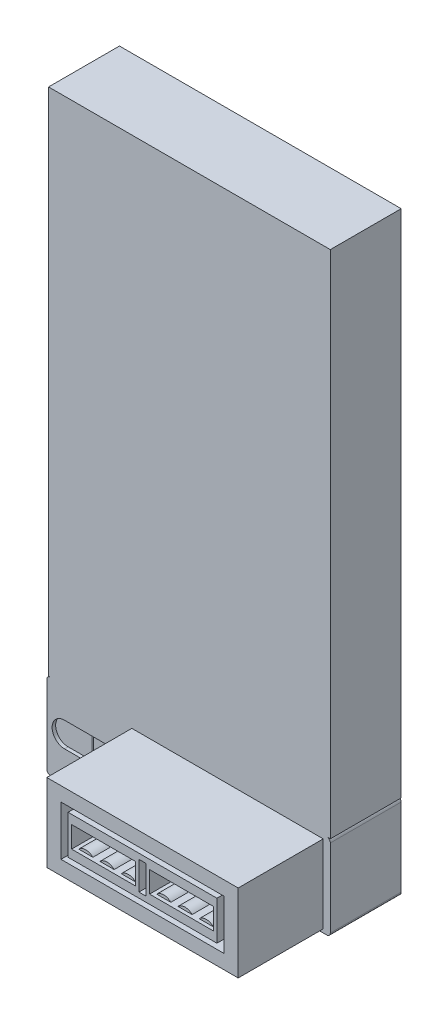
from build123d import *

# Parameters (mm, degrees)
SKETCH_1_W          = 27
SKETCH_1_H          = 11
EXTRUDE_1_DEPTH     = 12
SKETCH_2_W          = 23
SKETCH_2_H          = 7
CUT_EXTRUDE_1_DEPTH = 8
SKETCH_3_W          = 21
SKETCH_3_H          = 5.5
EXTRUDE_2_DEPTH     = 8
SKETCH_4_W          = 9
SKETCH_4_H          = 3
CUT_EXTRUDE_2_DEPTH = 4
SKETCH_5_W          = 1
SKETCH_5_H          = 4
CUT_EXTRUDE_3_DEPTH = 1
EXTRUDE_3_DEPTH     = 3.5
EXTRUDE_4_DEPTH     = 10
CUT_EXTRUDE_4_DEPTH = 0.5
SKETCH_9_W          = 0.2
SKETCH_9_H          = 3.5
EXTRUDE_5_DEPTH     = 0.1
SKETCH_10_W         = 39.75
SKETCH_10_H         = 10
EXTRUDE_6_DEPTH     = 72


with BuildPart() as part:
    # 草图1 → 凸台-拉伸1 (new body)
    with BuildSketch(Plane.XY):
        Rectangle(SKETCH_1_W, SKETCH_1_H)
    extrude(amount=EXTRUDE_1_DEPTH)

    # 草图2 → 切除-拉伸1 (cut)
    with BuildSketch(Plane.XY.offset(12)):
        Rectangle(SKETCH_2_W, SKETCH_2_H)
    extrude(amount=-CUT_EXTRUDE_1_DEPTH, mode=Mode.SUBTRACT)

    # 草图3 → 凸台-拉伸2 (add)
    with BuildSketch(Plane.XY.offset(4)):
        Rectangle(SKETCH_3_W, SKETCH_3_H)
    extrude(amount=EXTRUDE_2_DEPTH)

    # 草图4 → 切除-拉伸2 (cut)
    with BuildSketch(Plane.XY.offset(12)):
        with Locations((5.5, 0)):
            Rectangle(SKETCH_4_W, SKETCH_4_H)
        with Locations((-5.5, 0)):
            Rectangle(SKETCH_4_W, SKETCH_4_H)
    extrude(amount=-CUT_EXTRUDE_2_DEPTH, mode=Mode.SUBTRACT)

    # 草图5 → 切除-拉伸3 (cut)
    with BuildSketch(Plane.XY.offset(12)):
        Rectangle(SKETCH_5_W, SKETCH_5_H)
    extrude(amount=-CUT_EXTRUDE_3_DEPTH, mode=Mode.SUBTRACT)

    # 草图6 → 凸台-拉伸3 (add)
    with BuildSketch(Plane.XY.offset(8)):
        with BuildLine():
            Line((-7.5, -1.5), (-9.5, -1.5))
            ThreePointArc((-9.5, -1.5), (-8.5, -1.085786438), (-7.5, -1.5))
        make_face()
        with BuildLine():
            Line((-4.5, -1.5), (-6.5, -1.5))
            ThreePointArc((-6.5, -1.5), (-5.5, -1.085786438), (-4.5, -1.5))
        make_face()
        with BuildLine():
            Line((-3.5, -1.5), (-1.5, -1.5))
            ThreePointArc((-1.5, -1.5), (-2.5, -1.085786438), (-3.5, -1.5))
        make_face()
        with BuildLine():
            Line((3.5, -1.5), (1.5, -1.5))
            ThreePointArc((1.5, -1.5), (2.5, -1.085786438), (3.5, -1.5))
        make_face()
        with BuildLine():
            Line((4.5, -1.5), (6.5, -1.5))
            ThreePointArc((6.5, -1.5), (5.5, -1.085786438), (4.5, -1.5))
        make_face()
        with BuildLine():
            Line((7.5, -1.5), (9.5, -1.5))
            ThreePointArc((9.5, -1.5), (8.5, -1.085786438), (7.5, -1.5))
        make_face()
    extrude(amount=EXTRUDE_3_DEPTH)

    # 草图7 → 凸台-拉伸4 (add)
    with BuildSketch(Plane(origin=(0, 0, 0), x_dir=(-1, 0, 0), z_dir=(0, 0, -1))):
        with BuildLine():
            Line((-14, -6), (25, -6))
            ThreePointArc((25, -6), (25.353553391, -5.853553391), (25.5, -5.5))
            Line((25.5, -5.5), (25.5, 5.5))
            ThreePointArc((25.5, 5.5), (25.353553391, 5.853553391), (25, 6))
            Line((25, 6), (-14, 6))
            ThreePointArc((-14, 6), (-14.353553391, 5.853553391), (-14.5, 5.5))
            Line((-14.5, 5.5), (-14.5, -5.5))
            ThreePointArc((-14.5, -5.5), (-14.353553391, -5.853553391), (-14, -6))
        make_face()
    extrude(amount=EXTRUDE_4_DEPTH)

    # 草图8 → 切除-拉伸4 (cut)
    with BuildSketch(Plane.XY):
        with BuildLine():
            Line((-23, 1.75), (-16, 1.75))
            ThreePointArc((-16, 1.75), (-14.25, 0), (-16, -1.75))
            Line((-16, -1.75), (-23, -1.75))
            ThreePointArc((-23, -1.75), (-24.75, 0), (-23, 1.75))
        make_face()
    extrude(amount=-CUT_EXTRUDE_4_DEPTH, mode=Mode.SUBTRACT)

    # 草图9 → 凸台-拉伸5 (add)
    with BuildSketch(Plane.XY.offset(-0.5)):
        with Locations((-19.5, 0)):
            Rectangle(SKETCH_9_W, SKETCH_9_H)
    extrude(amount=EXTRUDE_5_DEPTH)

    # 草图10 → 凸台-拉伸6 (add)
    with BuildSketch(Plane.XZ.offset(-6)):
        with Locations((-5.375, -5)):
            Rectangle(SKETCH_10_W, SKETCH_10_H)
    extrude(amount=-EXTRUDE_6_DEPTH)


solid = part.part
